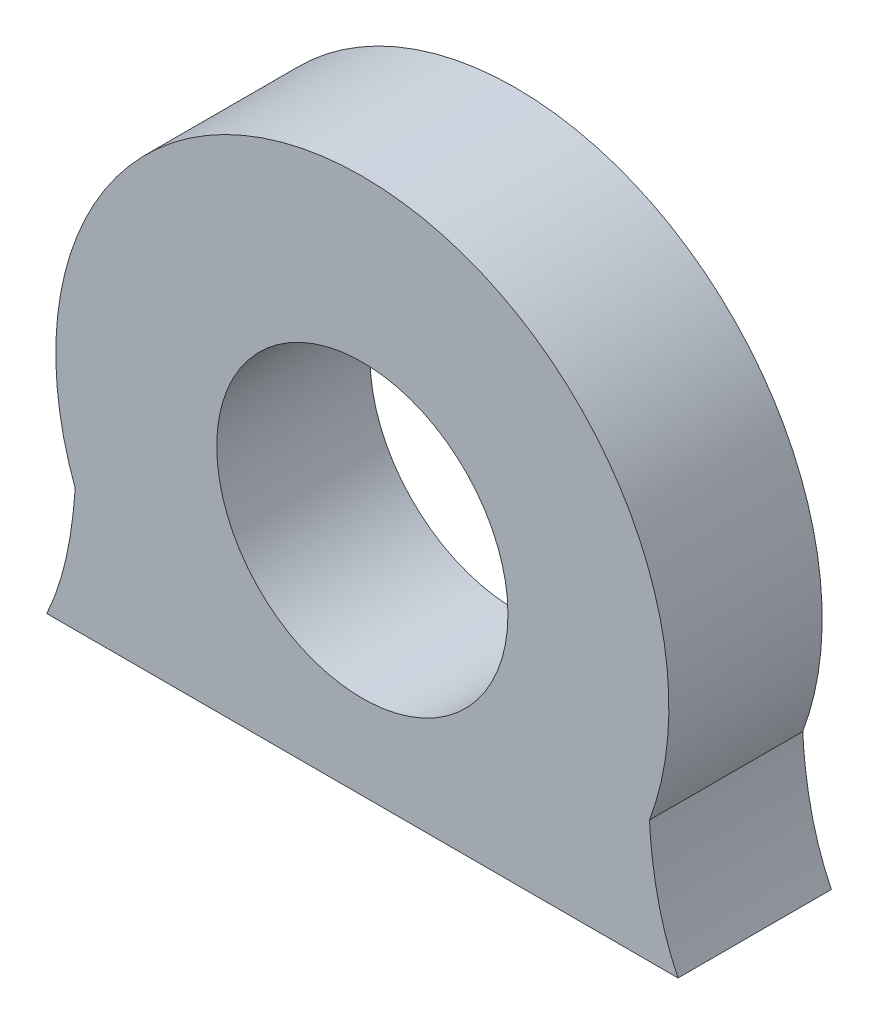
from build123d import *

# Parameters (mm, degrees)
SKETCH1_R           = 9.5
BOSS_EXTRUDE1_DEPTH = 10
SKETCH2_W           = 50.0481005
SKETCH2_H           = 5
CUT_EXTRUDE1_DEPTH  = 10


with BuildPart() as part:
    # Sketch1 → Boss-Extrude1 (new body)
    with BuildSketch(Plane.XY):
        with BuildLine():
            Line((-25, -20), (25, -20))
            add(Edge.make_bspline(
                [(18.732474137, -7.006740519), (19.213565223, -16.256662958), (25, -20)],
                knots=[0, 0, 0, 0.763362407, 0.763362407, 0.763362407], degree=2))
            ThreePointArc((18.732474137, -7.006740519), (0, 20), (-18.732474137, -7.006740519))
            add(Edge.make_bspline(
                [(-18.732474137, -7.006740519), (-19.393359213, -16.636844777), (-25, -20)],
                knots=[0, 0, 0, 0.631911459, 0.631911459, 0.631911459], degree=2))
        make_face()
        Circle(SKETCH1_R, mode=Mode.SUBTRACT)
    extrude(amount=BOSS_EXTRUDE1_DEPTH)

    # Sketch2 → Cut-Extrude1 (cut)
    with BuildSketch(Plane.XY.offset(10)):
        with Locations((0.02405025, -17.5)):
            Rectangle(SKETCH2_W, SKETCH2_H)
    extrude(amount=-CUT_EXTRUDE1_DEPTH, mode=Mode.SUBTRACT)


solid = part.part
